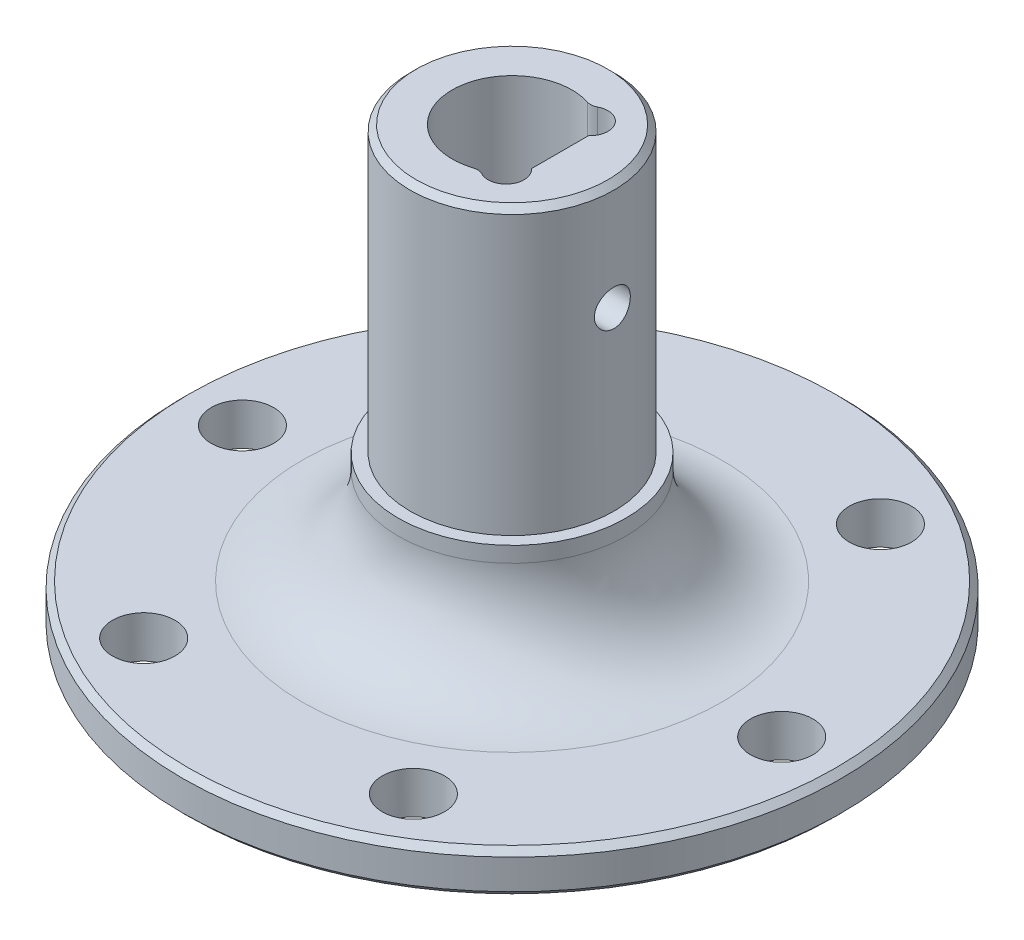
from build123d import *

# Parameters (mm, degrees)
SKETCH_1_R          = 10
EXTRUDE_1_DEPTH     = 1
SKETCH_2_R          = 27.5
EXTRUDE_2_DEPTH     = 3.5
SKETCH_3_R          = 8.5
EXTRUDE_3_DEPTH     = 33
SKETCH_4_R          = 5
CUT_EXTRUDE_1_DEPTH = 20
EXTRUDE_START       = -37.5
EXTRUDE_4_DEPTH     = 37.5
SKETCH_9_R          = 1.5
CUT_EXTRUDE_4_DEPTH = 15
SKETCH_10_R         = 9.5
SKETCH_10_R_2       = 8.5
EXTRUDE_5_DEPTH     = 9.3
FILLET_2_R          = 8
CHAMFER_1_SIZE      = 0.5
CHAMFER_2_SIZE      = 0.5
SKETCH_12_R         = 1.5
CUT_EXTRUDE_6_DEPTH = 20
SKETCH_13_R         = 3.75
CUT_EXTRUDE_7_DEPTH = 44.732139257
FILLET_3_R          = 1
CHAMFER_3_SIZE      = 0.5
SKETCH_14_R         = 2.6
CUT_EXTRUDE_8_DEPTH = 10


with BuildPart() as part:
    # 草图1 → 凸台-拉伸1 (new body)
    with BuildSketch(Plane(origin=(0, 0, 0), x_dir=(1, 0, 0), z_dir=(0, 1, 0))):
        with Locations(Location((0, 0, 0), (0, 0, 270))):
            Circle(SKETCH_1_R)
    extrude(amount=EXTRUDE_1_DEPTH)

    # 草图2 → 凸台-拉伸2 (add)
    with BuildSketch(Plane(origin=(0, 1, 0), x_dir=(1, 0, 0), z_dir=(0, 1, 0))):
        with Locations(Location((0, 0, 0), (0, 0, 270))):
            Circle(SKETCH_2_R)
    extrude(amount=EXTRUDE_2_DEPTH)

    # 草图3 → 凸台-拉伸3 (add)
    with BuildSketch(Plane(origin=(0, 4.5, 0), x_dir=(1, 0, 0), z_dir=(0, 1, 0))):
        with Locations(Location((0, 0, 0), (0, 0, 270))):
            Circle(SKETCH_3_R)
    extrude(amount=EXTRUDE_3_DEPTH)

    # 草图4 → 切除-拉伸1 (cut)
    with BuildSketch(Plane(origin=(0, 37.5, 0), x_dir=(1, 0, 0), z_dir=(0, 1, 0))):
        with Locations(Location((0, 0, 0), (0, 0, 270))):
            Circle(SKETCH_4_R)
    extrude(amount=-CUT_EXTRUDE_1_DEPTH, mode=Mode.SUBTRACT)

    # 草图8 → 凸台-拉伸4 (add)
    with BuildSketch(Plane.XZ.offset(EXTRUDE_START)):
        with BuildLine():
            Line((4, 3), (4, -3))
            ThreePointArc((4, -3), (5, 0), (4, 3))
        make_face()
    extrude(amount=EXTRUDE_4_DEPTH)

    # 草图9 → 切除-拉伸4 (cut, symmetric)
    with BuildSketch(Plane.ZY.offset(-4)):
        with Locations((0, 28.5)):
            Circle(SKETCH_9_R)
    extrude(amount=CUT_EXTRUDE_4_DEPTH, both=True, mode=Mode.SUBTRACT)

    # 草图10 → 凸台-拉伸5 (add)
    with BuildSketch(Plane(origin=(0, 4.5, 0), x_dir=(1, 0, 0), z_dir=(0, 1, 0))):
        with Locations(Location((0, 0, 0), (0, 0, 270))):
            Circle(SKETCH_10_R)
        with Locations(Location((0, 0, 0), (0, 0, 270))):
            Circle(SKETCH_10_R_2, mode=Mode.SUBTRACT)
    extrude(amount=EXTRUDE_5_DEPTH)

    # 圆角2
    fillet_2_edges = [part.edges().sort_by_distance(p)[0] for p in [
        (0, 4.5, -9.5),
    ]]
    fillet(fillet_2_edges, radius=FILLET_2_R)

    # 倒角1
    chamfer_1_edges = [part.edges().sort_by_distance(p)[0] for p in [
        (0, 4.5, -27.5),
    ]]
    chamfer(chamfer_1_edges, length=CHAMFER_1_SIZE)

    # 倒角2
    chamfer_2_edges = [part.edges().sort_by_distance(p)[0] for p in [
        (0, 37.5, -8.5),
    ]]
    chamfer(chamfer_2_edges, length=CHAMFER_2_SIZE)

    # 草图12 → 切除-拉伸6 (cut)
    with BuildSketch(Plane(origin=(0, 37.5, 0), x_dir=(1, 0, 0), z_dir=(0, 1, 0))):
        with Locations((3, 3.5)):
            Circle(SKETCH_12_R)
        with Locations((3, -3.5)):
            Circle(SKETCH_12_R)
    extrude(amount=-CUT_EXTRUDE_6_DEPTH, mode=Mode.SUBTRACT)

    # 草图13 → 切除-拉伸7 (cut, through all)
    with BuildSketch(Plane(origin=(0, 17.5, 0), x_dir=(1, 0, 0), z_dir=(0, 1, 0))):
        with Locations(Location((0, 0, 0), (0, 0, 270))):
            Circle(SKETCH_13_R)
    extrude(amount=-CUT_EXTRUDE_7_DEPTH, mode=Mode.SUBTRACT)

    # 圆角3
    fillet_3_edges = [part.edges().sort_by_distance(p)[0] for p in [
        (1.973716593, 27.5, -4.593957206),
        (1.973716593, 27.5, 4.593957206),
    ]]
    fillet(fillet_3_edges, radius=FILLET_3_R)

    # 倒角3
    chamfer_3_edges = [part.edges().sort_by_distance(p)[0] for p in [
        (0, 1, -27.5),
    ]]
    chamfer(chamfer_3_edges, length=CHAMFER_3_SIZE)

    # 草图14 → 切除-拉伸8 (cut)
    with BuildSketch(Plane.XZ.offset(-1)):
        with Locations(Location((22.5, 0, 0), (0, 0, 270))):
            Circle(SKETCH_14_R)
        with Locations(Location((11.25, -19.485571585, 0), (0, 0, 270))):
            Circle(SKETCH_14_R)
        with Locations(Location((-11.25, -19.485571585, 0), (0, 0, 270))):
            Circle(SKETCH_14_R)
        with Locations(Location((-22.5, 0, 0), (0, 0, 270))):
            Circle(SKETCH_14_R)
        with Locations(Location((-11.25, 19.485571585, 0), (0, 0, 270))):
            Circle(SKETCH_14_R)
        with Locations(Location((11.25, 19.485571585, 0), (0, 0, 270))):
            Circle(SKETCH_14_R)
    extrude(amount=-CUT_EXTRUDE_8_DEPTH, mode=Mode.SUBTRACT)


solid = part.part
